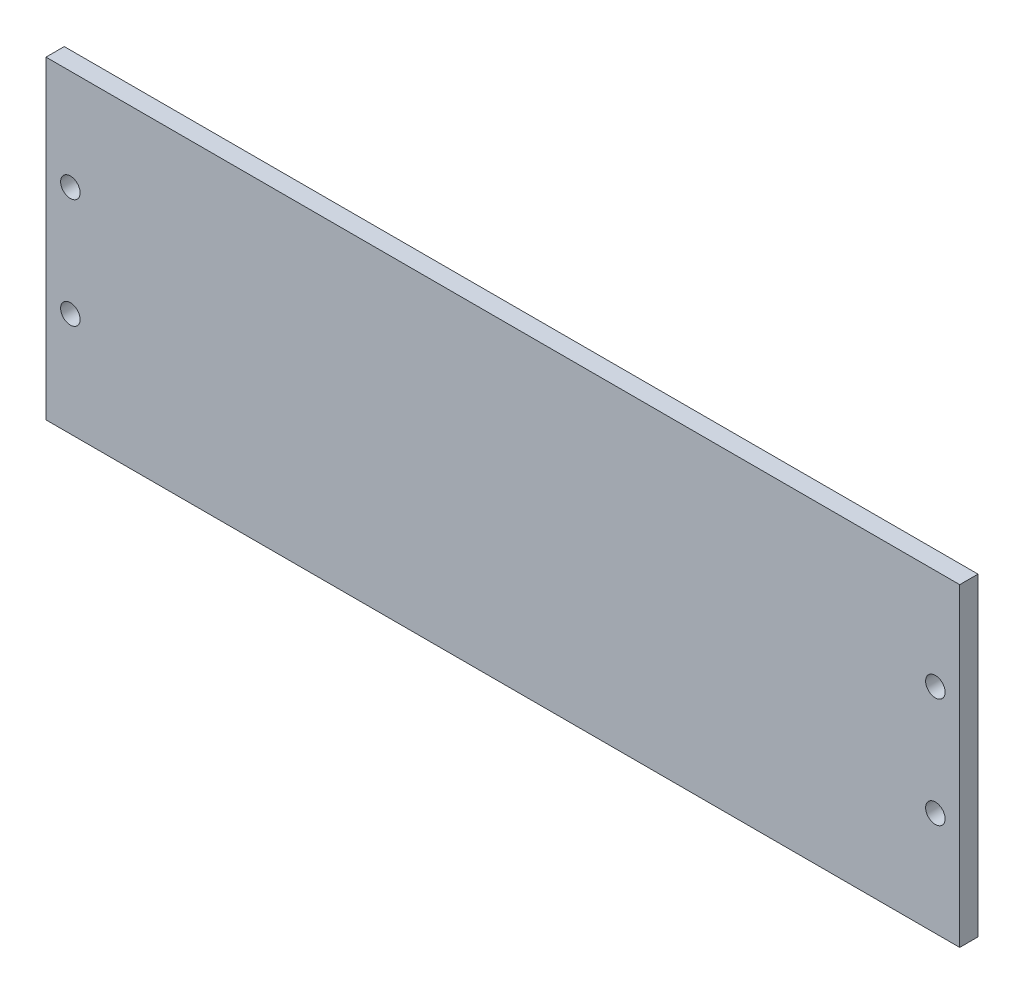
from build123d import *

# Parameters (mm, degrees)
SKETCH_1_W      = 150
SKETCH_1_H      = 51.578516668
SKETCH_1_R      = 1.6
EXTRUDE_1_DEPTH = 3


with BuildPart() as part:
    # 草图1 → 凸台-拉伸1 (new body)
    with BuildSketch(Plane.XY):
        with Locations((27.888283405, 67.928998275)):
            Rectangle(SKETCH_1_W, SKETCH_1_H)
        with Locations((-43.111716595, 77.218256609)):
            Circle(SKETCH_1_R, mode=Mode.SUBTRACT)
        with Locations((-43.111716595, 59.218256609)):
            Circle(SKETCH_1_R, mode=Mode.SUBTRACT)
        with Locations(Location((98.888283405, 59.218256609, 0), (0, 0, 180))):
            Circle(SKETCH_1_R, mode=Mode.SUBTRACT)
        with Locations(Location((98.888283405, 77.218256609, 0), (0, 0, 180))):
            Circle(SKETCH_1_R, mode=Mode.SUBTRACT)
    extrude(amount=-EXTRUDE_1_DEPTH)


solid = part.part
